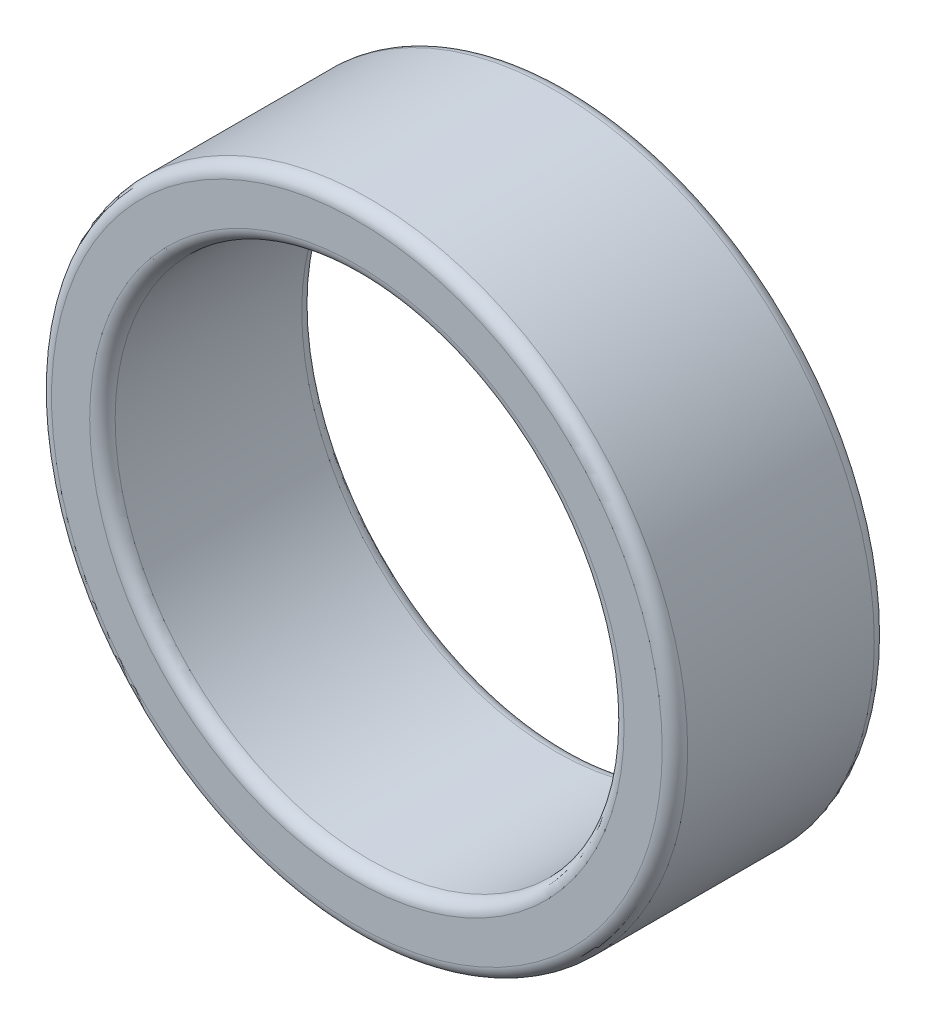
from build123d import *

# Parameters (mm, degrees)
SKETCH1_R           = 7.5
SKETCH1_R_2         = 6
BOSS_EXTRUDE1_DEPTH = 5
FILLET1_R           = 0.3


with BuildPart() as part:
    # Sketch1 → Boss-Extrude1 (new body)
    with BuildSketch(Plane.XY):
        Circle(SKETCH1_R)
        Circle(SKETCH1_R_2, mode=Mode.SUBTRACT)
    extrude(amount=-BOSS_EXTRUDE1_DEPTH)

    # Fillet1
    fillet1_edges = [part.edges().sort_by_distance(p)[0] for p in [
        (-7.5, 0, 0),
        (-7.5, 0, -5),
        (-6, 0, -5),
        (-6, 0, 0),
    ]]
    fillet(fillet1_edges, radius=FILLET1_R)


solid = part.part
